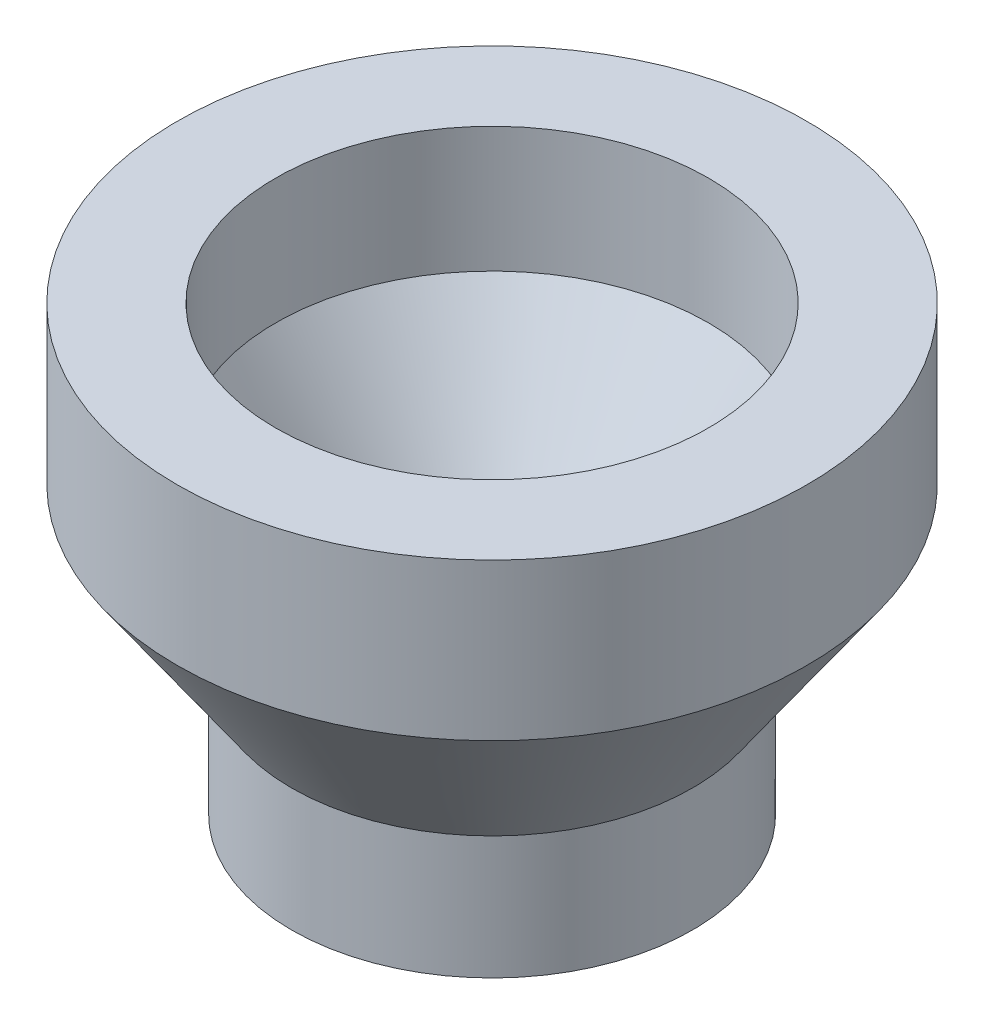
from build123d import *


with BuildPart() as part:
    # 草图1 → 旋转1 (revolve)
    with BuildSketch(Plane.XY, mode=Mode.PRIVATE) as revolve_1_sk:
        Polygon((-2.575, 25.437282567), (-2.575, 29.281954148), (-4.4, 31.888324261), (-4.4, 34.437282567), (-6.4, 34.437282567), (-6.4, 31.257726683), (-4.075, 27.937282567), (-4.075, 25.437282567), align=None)
    revolve(revolve_1_sk.sketch.rotate(Axis((0, 71.491491652, 0), (0, -1, 0)), 270), axis=Axis((0, 71.491491652, 0), (0, -1, 0)))


solid = part.part
